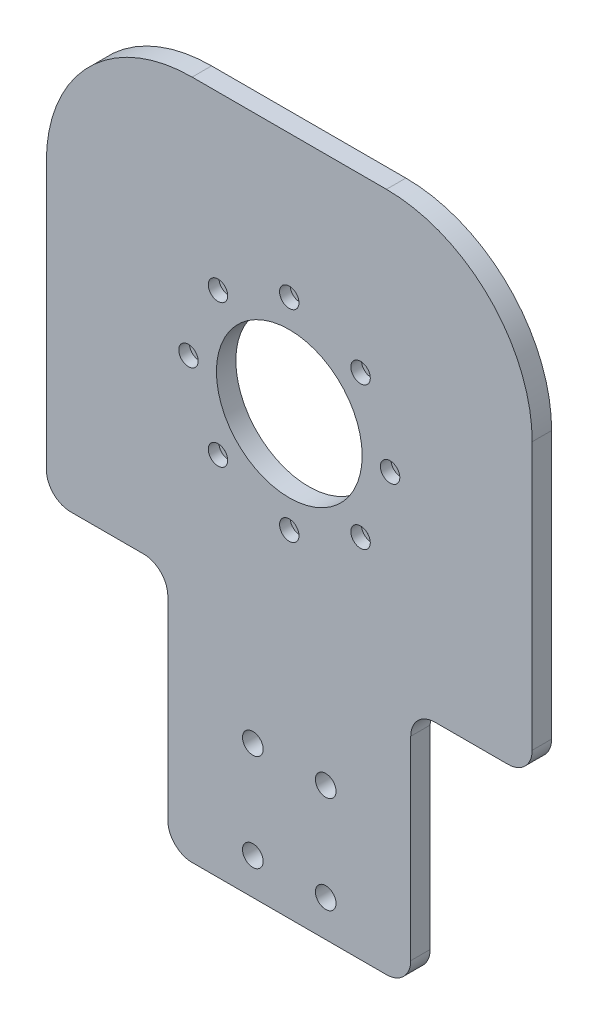
from build123d import *

# Parameters (mm, degrees)
SKETCH_1_W          = 200
SKETCH_1_H          = 400
EXTRUDE_1_DEPTH     = 8
SKETCH_2_R          = 30
CUT_EXTRUDE_1_DEPTH = 10
SKETCH_3_R          = 2.25
CUT_EXTRUDE_2_DEPTH = 10
SKETCH_4_R          = 4
CUT_EXTRUDE_3_DEPTH = 4.4
FILLET_1_R          = 60
SKETCH_5_R          = 4.25
CUT_EXTRUDE_4_DEPTH = 10
SKETCH_6_W          = 50
SKETCH_6_H          = 220
CUT_EXTRUDE_5_DEPTH = 10
FILLET_2_R          = 10
SKETCH_7_W          = 100
SKETCH_7_H          = 120
CUT_EXTRUDE_6_DEPTH = 84
FILLET_3_R          = 10


with BuildPart() as part:
    # 草图1 → 凸台-拉伸1 (new body)
    with BuildSketch(Plane.XY):
        with Locations((0, 200)):
            Rectangle(SKETCH_1_W, SKETCH_1_H)
    extrude(amount=EXTRUDE_1_DEPTH)

    # 草图2 → 切除-拉伸1 (cut)
    with BuildSketch(Plane(origin=(0, 0, 0), x_dir=(-1, 0, 0), z_dir=(0, 0, -1))):
        with Locations((0, 300)):
            Circle(SKETCH_2_R)
    extrude(amount=-CUT_EXTRUDE_1_DEPTH, mode=Mode.SUBTRACT)

    # 草图3 → 切除-拉伸2 (cut)
    with BuildSketch(Plane(origin=(0, 0, 0), x_dir=(-1, 0, 0), z_dir=(0, 0, -1))):
        with Locations((0, 341.5)):
            Circle(SKETCH_3_R)
        with Locations((29.344931419, 329.344931419)):
            Circle(SKETCH_3_R)
        with Locations((41.5, 300)):
            Circle(SKETCH_3_R)
        with Locations((29.344931419, 270.655068581)):
            Circle(SKETCH_3_R)
        with Locations((0, 258.5)):
            Circle(SKETCH_3_R)
        with Locations((-29.344931419, 270.655068581)):
            Circle(SKETCH_3_R)
        with Locations((-41.5, 300)):
            Circle(SKETCH_3_R)
        with Locations((-29.344931419, 329.344931419)):
            Circle(SKETCH_3_R)
    extrude(amount=-CUT_EXTRUDE_2_DEPTH, mode=Mode.SUBTRACT)

    # 草图4 → 切除-拉伸3 (cut)
    with BuildSketch(Plane.XY.offset(8)):
        with Locations((29.344931419, 329.344931419)):
            Circle(SKETCH_4_R)
        with Locations((41.5, 300)):
            Circle(SKETCH_4_R)
        with Locations((29.344931419, 270.655068581)):
            Circle(SKETCH_4_R)
        with Locations((0, 258.5)):
            Circle(SKETCH_4_R)
        with Locations((-29.344931419, 270.655068581)):
            Circle(SKETCH_4_R)
        with Locations((-41.5, 300)):
            Circle(SKETCH_4_R)
        with Locations((-29.344931419, 329.344931419)):
            Circle(SKETCH_4_R)
        with Locations((0, 341.5)):
            Circle(SKETCH_4_R)
    extrude(amount=-CUT_EXTRUDE_3_DEPTH, mode=Mode.SUBTRACT)

    # 圆角1
    fillet_1_edges = [part.edges().sort_by_distance(p)[0] for p in [
        (100, 400, 4),
        (-100, 400, 4),
    ]]
    fillet(fillet_1_edges, radius=FILLET_1_R)

    # 草图5 → 切除-拉伸4 (cut)
    with BuildSketch(Plane(origin=(0, 0, 0), x_dir=(-1, 0, 0), z_dir=(0, 0, -1))):
        with Locations((-15, 25)):
            Circle(SKETCH_5_R)
        with Locations((15, 25)):
            Circle(SKETCH_5_R)
        with Locations((-15, 65)):
            Circle(SKETCH_5_R)
        with Locations((15, 65)):
            Circle(SKETCH_5_R)
        with Locations((-15, 175)):
            Circle(SKETCH_5_R)
        with Locations((-15, 135)):
            Circle(SKETCH_5_R)
        with Locations((15, 135)):
            Circle(SKETCH_5_R)
        with Locations((15, 175)):
            Circle(SKETCH_5_R)
    extrude(amount=-CUT_EXTRUDE_4_DEPTH, mode=Mode.SUBTRACT)

    # 草图6 → 切除-拉伸5 (cut)
    with BuildSketch(Plane.XY.offset(8)):
        with Locations((-75, 110)):
            Rectangle(SKETCH_6_W, SKETCH_6_H)
        with Locations((75, 110)):
            Rectangle(SKETCH_6_W, SKETCH_6_H)
    extrude(amount=-CUT_EXTRUDE_5_DEPTH, mode=Mode.SUBTRACT)

    # 圆角2
    fillet_2_edges = [part.edges().sort_by_distance(p)[0] for p in [
        (100, 220, 4),
        (50, 220, 4),
        (-100, 220, 4),
        (-50, 220, 4),
    ]]
    fillet(fillet_2_edges, radius=FILLET_2_R)

    # 草图7 → 切除-拉伸6 (cut)
    with BuildSketch(Plane(origin=(0, 0, 0), x_dir=(-1, 0, 0), z_dir=(0, 0, -1))):
        with Locations((0, 60)):
            Rectangle(SKETCH_7_W, SKETCH_7_H)
    extrude(amount=-CUT_EXTRUDE_6_DEPTH, mode=Mode.SUBTRACT)

    # 圆角3
    fillet_3_edges = [part.edges().sort_by_distance(p)[0] for p in [
        (50, 120, 4),
        (-50, 120, 4),
    ]]
    fillet(fillet_3_edges, radius=FILLET_3_R)


solid = part.part
